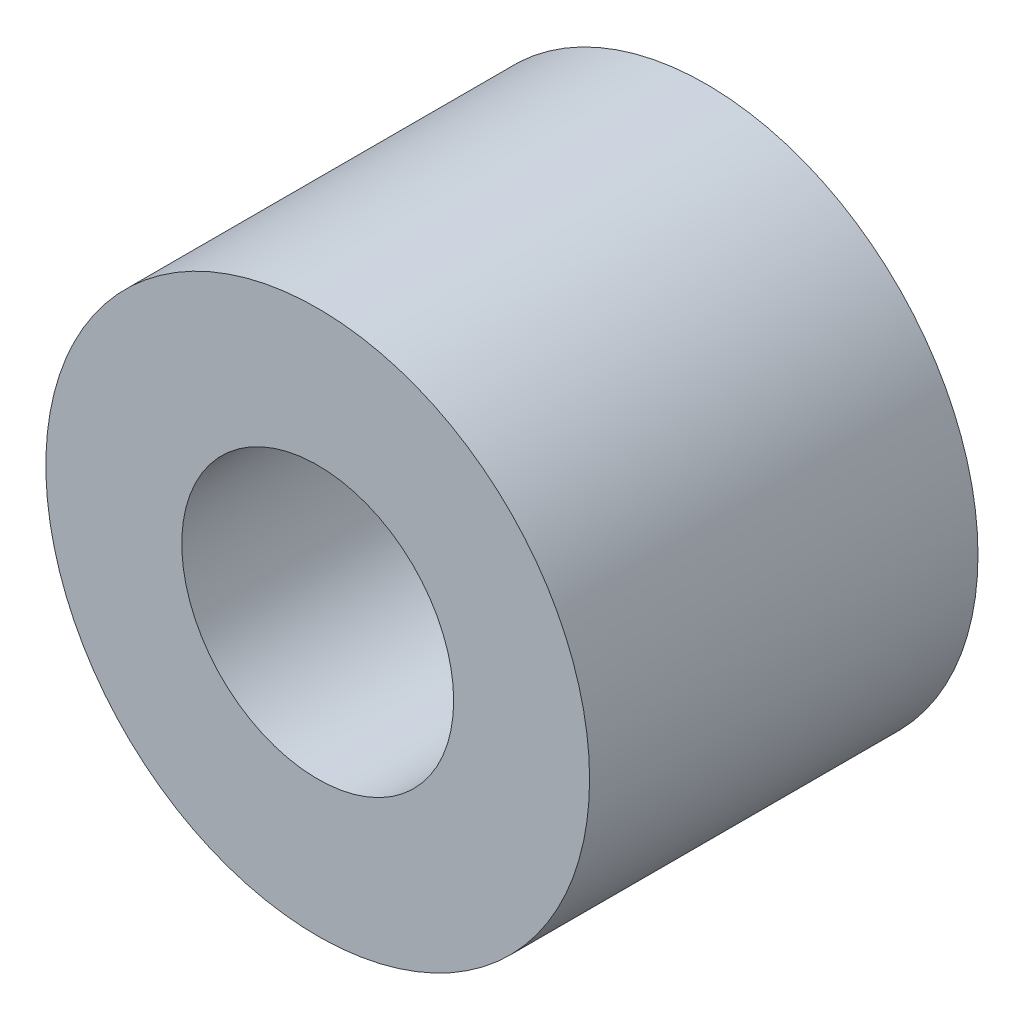
from build123d import *

# Parameters (mm, degrees)
SKETCH1_R           = 3.5
SKETCH1_R_2         = 1.75
BOSS_EXTRUDE1_DEPTH = 2.5


with BuildPart() as part:
    # Sketch1 → Boss-Extrude1 (new, symmetric)
    with BuildSketch(Plane.XY):
        Circle(SKETCH1_R)
        Circle(SKETCH1_R_2, mode=Mode.SUBTRACT)
    extrude(amount=BOSS_EXTRUDE1_DEPTH, both=True)


solid = part.part
